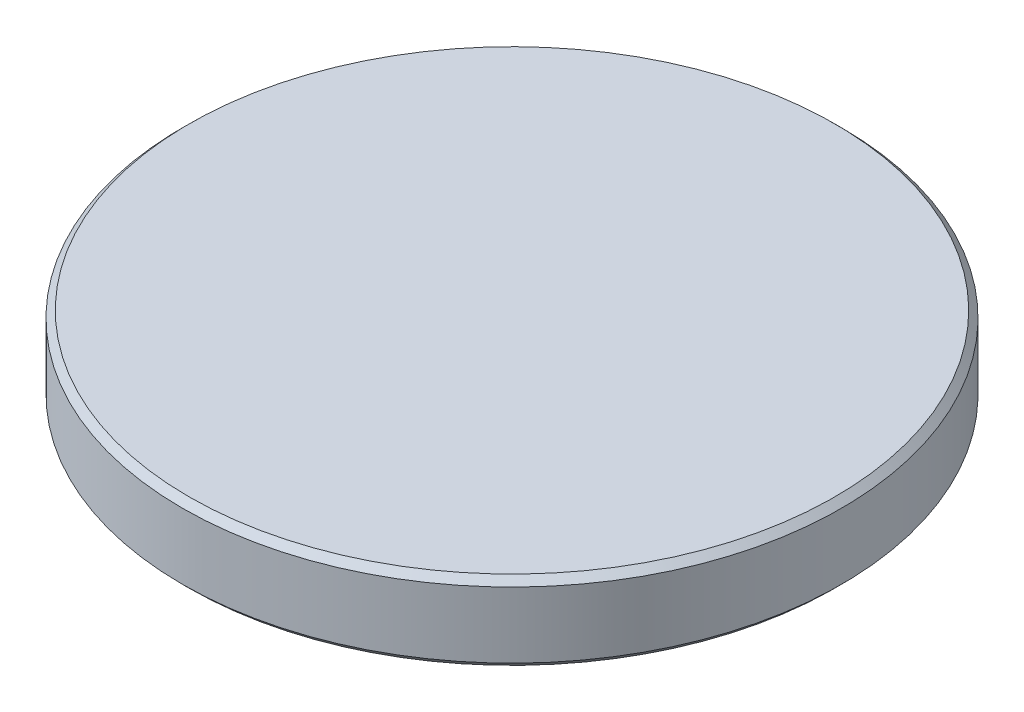
from build123d import *

# Parameters (mm, degrees)
SKETCH1_R           = 12.5
BOSS_EXTRUDE1_DEPTH = 3
CHAMFER1_SIZE       = 0.25


with BuildPart() as part:
    # Sketch1 → Boss-Extrude1 (new body)
    with BuildSketch(Plane(origin=(0, 0, 0), x_dir=(1, 0, 0), z_dir=(0, 1, 0))):
        with Locations(Location((0, 0, 0), (0, 0, 270))):
            Circle(SKETCH1_R)
    extrude(amount=BOSS_EXTRUDE1_DEPTH)

    # Chamfer1
    chamfer1_edges = [part.edges().sort_by_distance(p)[0] for p in [
        (0, 0, -12.5),
        (0, 3, -12.5),
    ]]
    chamfer(chamfer1_edges, length=CHAMFER1_SIZE)


solid = part.part
